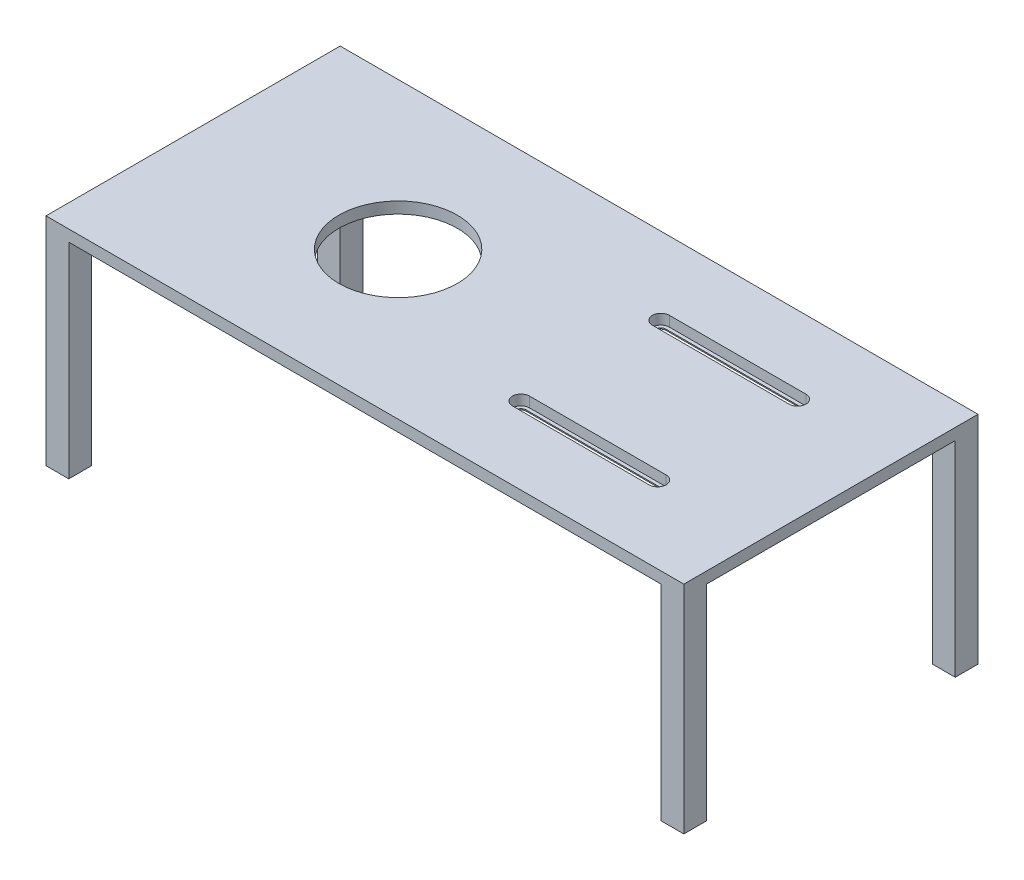
from build123d import *

# Parameters (mm, degrees)
SZKIC1_R                         = 26
DODANIE_WYCI_GNI_CIE1_DEPTH      = 5
DODANIE_WYCI_GNI_CIE2_DEPTH      = 5
DODANIE_WYCI_GNI_CIE2_DEPTH_BACK = 90
SZKIC1_3_W                       = 10
SZKIC1_3_H                       = 10
WYTNIJ_WYCI_GNI_CIE1_DEPTH       = 323.646908993
WYTNIJ_WYCI_GNI_CIE2_DEPTH       = 4.5


with BuildPart() as part:
    # Szkic1 → Dodanie-wyciągnięcie1 (new body)
    with BuildSketch(Plane(origin=(0, 0, 0), x_dir=(1, 0, 0), z_dir=(0, 1, 0))):
        Polygon((10, 10), (10, 0), (270, 0), (270, 10), (280, 10), (280, 119.135695619), (270, 119.135695619), (270, 129.135695619), (10, 129.135695619), (10, 119.135695619), (0, 119.135695619), (0, 10), align=None)
        with Locations((90, 64.567847809)):
            Circle(SZKIC1_R, mode=Mode.SUBTRACT)
    extrude(amount=DODANIE_WYCI_GNI_CIE1_DEPTH)

    # Szkic1<3> → Dodanie-wyciągnięcie2 (add, two sides: drawn at the far end of the back side and taken through both)
    with BuildSketch(Plane(origin=(0, 0, 0), x_dir=(1, 0, 0), z_dir=(0, 1, 0)).offset(-DODANIE_WYCI_GNI_CIE2_DEPTH_BACK)):
        with Locations((5, 5)):
            Rectangle(SZKIC1_3_W, SZKIC1_3_H)
        with Locations((275, 5)):
            Rectangle(SZKIC1_3_W, SZKIC1_3_H)
        with Locations((5, 124.135695619)):
            Rectangle(SZKIC1_3_W, SZKIC1_3_H)
        with Locations((275, 124.135695619)):
            Rectangle(SZKIC1_3_W, SZKIC1_3_H)
    extrude(amount=DODANIE_WYCI_GNI_CIE2_DEPTH + DODANIE_WYCI_GNI_CIE2_DEPTH_BACK)

    # Szkic2 → Wytnij-wyciągnięcie1 (cut, through all)
    with BuildSketch(Plane(origin=(0, 5, 0), x_dir=(1, 0, 0), z_dir=(0, 1, 0))):
        with BuildLine():
            Line((234.634543985, 97.517847809), (174.634543985, 97.517847809))
            ThreePointArc((174.634543985, 97.517847809), (172.384543985, 95.267847809), (174.634543985, 93.017847809))
            Line((174.634543985, 93.017847809), (234.634543985, 93.017847809))
            ThreePointArc((234.634543985, 93.017847809), (236.884543985, 95.267847809), (234.634543985, 97.517847809))
        make_face()
        with BuildLine():
            ThreePointArc((174.634543985, 36.117847809), (172.384543985, 33.867847809), (174.634543985, 31.617847809))
            Line((174.634543985, 31.617847809), (234.634543985, 31.617847809))
            ThreePointArc((234.634543985, 31.617847809), (236.884543985, 33.867847809), (234.634543985, 36.117847809))
            Line((234.634543985, 36.117847809), (174.634543985, 36.117847809))
        make_face()
    extrude(amount=-WYTNIJ_WYCI_GNI_CIE1_DEPTH, mode=Mode.SUBTRACT)

    # Szkic2<3> → Wytnij-wyciągnięcie2 (cut)
    # profile 1 of 2: a face of its own
    with BuildSketch(Plane(origin=(0, 5, 0), x_dir=(1, 0, 0), z_dir=(0, 1, 0))):
        with BuildLine():
            Line((174.634543985, 99.017847809), (234.634543985, 99.017847809))
            ThreePointArc((234.634543985, 99.017847809), (238.384543985, 95.267847809), (234.634543985, 91.517847809))
            Line((234.634543985, 91.517847809), (174.634543985, 91.517847809))
            ThreePointArc((174.634543985, 91.517847809), (170.884543985, 95.267847809), (174.634543985, 99.017847809))
        make_face()
        with BuildLine():
            Line((174.634543985, 97.517847809), (234.634543985, 97.517847809))
            ThreePointArc((234.634543985, 97.517847809), (236.884543985, 95.267847809), (234.634543985, 93.017847809))
            Line((234.634543985, 93.017847809), (174.634543985, 93.017847809))
            ThreePointArc((174.634543985, 93.017847809), (172.384543985, 95.267847809), (174.634543985, 97.517847809))
        make_face(mode=Mode.SUBTRACT)
    # profile 2 of 2: a face of its own
    with BuildSketch(Plane(origin=(0, 5, 0), x_dir=(1, 0, 0), z_dir=(0, 1, 0))):
        with BuildLine():
            Line((174.634543985, 30.117847809), (234.634543985, 30.117847809))
            ThreePointArc((234.634543985, 30.117847809), (238.384543985, 33.867847809), (234.634543985, 37.617847809))
            Line((234.634543985, 37.617847809), (174.634543985, 37.617847809))
            ThreePointArc((174.634543985, 37.617847809), (170.884543985, 33.867847809), (174.634543985, 30.117847809))
        make_face()
        with BuildLine():
            Line((174.634543985, 31.617847809), (234.634543985, 31.617847809))
            ThreePointArc((234.634543985, 31.617847809), (236.884543985, 33.867847809), (234.634543985, 36.117847809))
            Line((234.634543985, 36.117847809), (174.634543985, 36.117847809))
            ThreePointArc((174.634543985, 36.117847809), (172.384543985, 33.867847809), (174.634543985, 31.617847809))
        make_face(mode=Mode.SUBTRACT)
    extrude(amount=-WYTNIJ_WYCI_GNI_CIE2_DEPTH, mode=Mode.SUBTRACT)


solid = part.part
